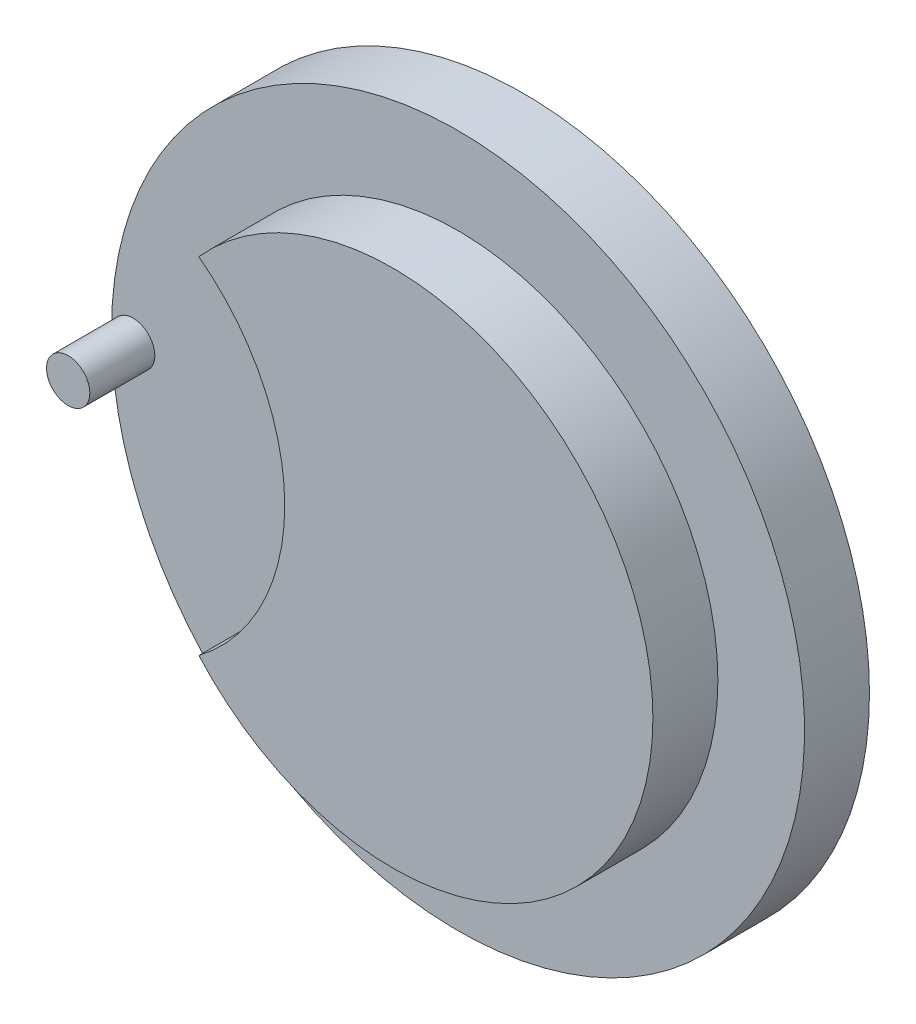
from build123d import *

# Parameters (mm, degrees)
SKETCH1_R           = 50.8
BOSS_EXTRUDE1_DEPTH = 9.525
SKETCH2_R           = 3.175
BOSS_EXTRUDE2_DEPTH = 9.525
SKETCH7_R           = 4.7625
SKETCH7_W           = 5.08
SKETCH7_H           = 10.16
CUT_EXTRUDE10_DEPTH = 9.525


with BuildPart() as part:
    # Sketch1 → Boss-Extrude1 (new body)
    with BuildSketch(Plane.XY):
        with Locations(Location((0, 0, 0), (0, 0, 180))):
            Circle(SKETCH1_R)
    extrude(amount=BOSS_EXTRUDE1_DEPTH)

    # Sketch2 → Boss-Extrude2 (add)
    with BuildSketch(Plane.XY.offset(9.525)):
        with BuildLine():
            ThreePointArc((-28.469166667, 25.320279408), (-19.197370761, 14.139745253), (-15.875, 0))
            ThreePointArc((-15.875, 0), (-19.197370761, -14.139745253), (-28.469166667, -25.320279408))
            ThreePointArc((-28.469166667, -25.320279408), (38.1, 0), (-28.469166667, 25.320279408))
        make_face()
        with Locations(Location((-47.625, 0, 0), (0, 0, 179.999530418))):
            Circle(SKETCH2_R)
    extrude(amount=BOSS_EXTRUDE2_DEPTH)

    # Sketch7 → Cut-Extrude10 (cut)
    with BuildSketch(Plane(origin=(0, 0, 0), x_dir=(-1, 0, 0), z_dir=(0, 0, -1))):
        Circle(SKETCH7_R)
        with Locations((0, 5.08)):
            Rectangle(SKETCH7_W, SKETCH7_H)
    extrude(amount=-CUT_EXTRUDE10_DEPTH, mode=Mode.SUBTRACT)


solid = part.part
